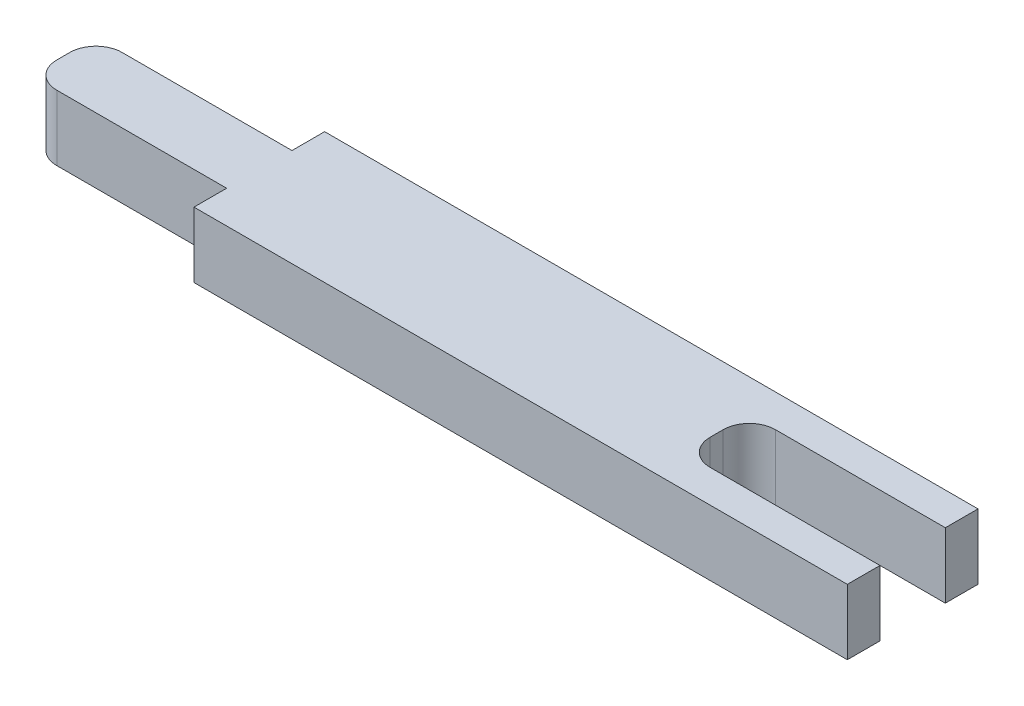
from build123d import *

# Parameters (mm, degrees)
CROQUIS1_W              = 50
CROQUIS1_H              = 10
SALIENTE_EXTRUIR1_DEPTH = 2.5
CORTAR_EXTRUIR1_DEPTH   = 52.23475383
SALIENTE_EXTRUIR2_DEPTH = 5


with BuildPart() as part:
    # Croquis1 → Saliente-Extruir1 (new, symmetric)
    with BuildSketch(Plane(origin=(0, 0, 0), x_dir=(1, 0, 0), z_dir=(0, 1, 0))):
        with Locations((25, 5)):
            Rectangle(CROQUIS1_W, CROQUIS1_H)
    extrude(amount=SALIENTE_EXTRUIR1_DEPTH, both=True)

    # Croquis2 → Cortar-Extruir1 (cut, through all)
    with BuildSketch(Plane(origin=(0, 2.5, 0), x_dir=(1, 0, 0), z_dir=(0, 1, 0))):
        with BuildLine():
            Line((50, 7.5), (37, 7.5))
            ThreePointArc((37, 7.5), (35.585786438, 6.914213562), (35, 5.5))
            Line((35, 5.5), (35, 4.5))
            ThreePointArc((35, 4.5), (35.585786438, 3.085786438), (37, 2.5))
            Line((37, 2.5), (50, 2.5))
            Line((50, 2.5), (50, 7.5))
        make_face()
    extrude(amount=-CORTAR_EXTRUIR1_DEPTH, mode=Mode.SUBTRACT)

    # Croquis3 → Saliente-Extruir2 (add)
    with BuildSketch(Plane(origin=(0, 2.5, 0), x_dir=(1, 0, 0), z_dir=(0, 1, 0))):
        with BuildLine():
            Line((0, 2.5), (-13, 2.5))
            ThreePointArc((-13, 2.5), (-14.414213562, 3.085786438), (-15, 4.5))
            Line((-15, 4.5), (-15, 5.5))
            ThreePointArc((-15, 5.5), (-14.414213562, 6.914213562), (-13, 7.5))
            Line((-13, 7.5), (0, 7.5))
            Line((0, 7.5), (0, 2.5))
        make_face()
    extrude(amount=-SALIENTE_EXTRUIR2_DEPTH)


solid = part.part
